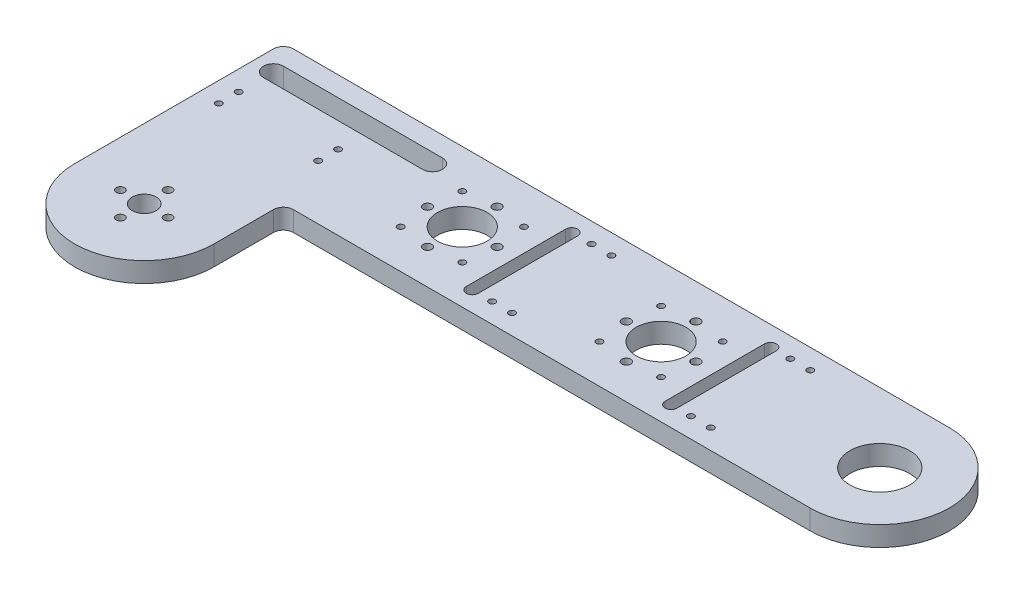
from build123d import *

# Parameters (mm, degrees)
SKETCH1_R               = 6
SKETCH1_R_2             = 15
BOSS_EXTRUDE1_DEPTH     = 5
FILLET1_R               = 5
SKETCH3_R               = 2.1
CUT_EXTRUDE1_DEPTH      = 352.212186577
CIRPATTERN1_COUNT       = 4
CUT_EXTRUDE2_DEPTH      = 352.212186577
CUT_EXTRUDE2_DEPTH_BACK = 352.212186577
SKETCH4_R               = 1.6
SKETCH5_R               = 1.6
SKETCH5_R_2             = 12.5
CUT_EXTRUDE3_DEPTH      = 352.212186577
SKETCH7_R               = 2.2
CUT_EXTRUDE5_DEPTH      = 352.212186577
LPATTERN1_COUNT         = 2
LPATTERN1_PITCH         = 100
CUT_EXTRUDE4_DEPTH      = 352.212186577
CUT_EXTRUDE4_DEPTH_BACK = 352.212186577


with BuildPart() as part:
    # Sketch1 → Boss-Extrude1 (new, symmetric)
    with BuildSketch(Plane(origin=(0, 0, 0), x_dir=(1, 0, 0), z_dir=(0, 1, 0))):
        with BuildLine():
            Line((35, 0), (35, 35))
            Line((35, 35), (300, 35))
            ThreePointArc((300, 35), (335, 70), (300, 105))
            Line((300, 105), (-35, 105))
            Line((-35, 105), (-35, 0))
            ThreePointArc((-35, 0), (0, -35), (35, 0))
        make_face()
        with Locations(Location((0, 0, 0), (0, 0, 270))):
            Circle(SKETCH1_R, mode=Mode.SUBTRACT)
        with Locations(Location((300, 70, 0), (0, 0, 270))):
            Circle(SKETCH1_R_2, mode=Mode.SUBTRACT)
    extrude(amount=BOSS_EXTRUDE1_DEPTH, both=True)

    # Fillet1
    fillet1_edges = [part.edges().sort_by_distance(p)[0] for p in [
        (-35, 0, -105),
        (35, 0, -35),
    ]]
    fillet(fillet1_edges, radius=FILLET1_R)

    # Sketch3 → Cut-Extrude1 (cut, symmetric)
    with BuildSketch(Plane(origin=(0, 5, 0), x_dir=(1, 0, 0), z_dir=(0, 1, 0))):
        with Locations(Location((0, -12, 0), (0, 0, 270))):
            Circle(SKETCH3_R)
    cut_extrude1 = extrude(amount=CUT_EXTRUDE1_DEPTH, both=True, mode=Mode.SUBTRACT)

    # CirPattern1: Cut-Extrude1 ×4 about axis
    cirpattern1_axis = Axis((0, 0, 0), (0, 1, 0))
    for i in range(1, CIRPATTERN1_COUNT):
        add(cut_extrude1.rotate(cirpattern1_axis, i * 360 / CIRPATTERN1_COUNT), mode=Mode.SUBTRACT)

    # Sketch4 → Cut-Extrude2 (cut, two sides: drawn at the far end of the back side and taken through both)
    with BuildSketch(Plane(origin=(0, 5, 0), x_dir=(1, 0, 0), z_dir=(0, 1, 0)).offset(-CUT_EXTRUDE2_DEPTH_BACK)):
        with Locations(Location((230, 95, 0), (0, 0, 270))):
            Circle(SKETCH4_R)
        with Locations(Location((240, 95, 0), (0, 0, 270))):
            Circle(SKETCH4_R)
        with Locations(Location((230, 45, 0), (0, 0, 270))):
            Circle(SKETCH4_R)
        with Locations(Location((240, 45, 0), (0, 0, 270))):
            Circle(SKETCH4_R)
        with Locations(Location((-25, 72.5, 0), (0, 0, 270))):
            Circle(SKETCH4_R)
        with Locations(Location((25, 72.5, 0), (0, 0, 270))):
            Circle(SKETCH4_R)
        with Locations(Location((-25, 62.5, 0), (0, 0, 270))):
            Circle(SKETCH4_R)
        with Locations(Location((25, 62.5, 0), (0, 0, 270))):
            Circle(SKETCH4_R)
        with Locations(Location((130, 95, 0), (0, 0, 270))):
            Circle(SKETCH4_R)
        with Locations(Location((140, 95, 0), (0, 0, 270))):
            Circle(SKETCH4_R)
        with Locations(Location((130, 45, 0), (0, 0, 270))):
            Circle(SKETCH4_R)
        with Locations(Location((140, 45, 0), (0, 0, 270))):
            Circle(SKETCH4_R)
    extrude(amount=CUT_EXTRUDE2_DEPTH + CUT_EXTRUDE2_DEPTH_BACK, mode=Mode.SUBTRACT)

    # Sketch5 → Cut-Extrude3 (cut, symmetric)
    with BuildSketch(Plane(origin=(0, 5, 0), x_dir=(1, 0, 0), z_dir=(0, 1, 0))):
        with Locations(Location((174.5, 85.5, 0), (0, 0, 270))):
            Circle(SKETCH5_R)
        with Locations(Location((174.5, 54.5, 0), (0, 0, 270))):
            Circle(SKETCH5_R)
        with Locations(Location((205.5, 54.5, 0), (0, 0, 270))):
            Circle(SKETCH5_R)
        with Locations(Location((205.5, 85.5, 0), (0, 0, 270))):
            Circle(SKETCH5_R)
        with Locations(Location((190, 70, 0), (0, 0, 270))):
            Circle(SKETCH5_R_2)
        with BuildLine():
            Line((223, 95), (223, 45))
            ThreePointArc((223, 45), (220, 42), (217, 45))
            Line((217, 45), (217, 95))
            ThreePointArc((217, 95), (220, 98), (223, 95))
        make_face()
    cut_extrude3 = extrude(amount=CUT_EXTRUDE3_DEPTH, both=True, mode=Mode.SUBTRACT)

    # Sketch7 → Cut-Extrude5 (cut, through all)
    with BuildSketch(Plane(origin=(0, 5, 0), x_dir=(1, 0, 0), z_dir=(0, 1, 0))):
        with Locations(Location((190, 87.5, 0), (0, 0, 270))):
            Circle(SKETCH7_R)
        with Locations(Location((172.5, 70, 0), (0, 0, 270))):
            Circle(SKETCH7_R)
        with Locations(Location((190, 52.5, 0), (0, 0, 270))):
            Circle(SKETCH7_R)
        with Locations(Location((207.5, 70, 0), (0, 0, 270))):
            Circle(SKETCH7_R)
    cut_extrude5 = extrude(amount=-CUT_EXTRUDE5_DEPTH, mode=Mode.SUBTRACT)

    # LPattern1: Cut-Extrude3, Cut-Extrude5 ×2
    with Locations(*[(-i * LPATTERN1_PITCH, 0, 0) for i in range(1, LPATTERN1_COUNT)]):
        add(cut_extrude3, mode=Mode.SUBTRACT)
        add(cut_extrude5, mode=Mode.SUBTRACT)

    # Sketch6 → Cut-Extrude4 (cut, two sides: drawn at the far end of the back side and taken through both)
    with BuildSketch(Plane(origin=(0, 5, 0), x_dir=(1, 0, 0), z_dir=(0, 1, 0)).offset(-CUT_EXTRUDE4_DEPTH_BACK)):
        with BuildLine():
            Line((-25, 95), (55, 95))
            ThreePointArc((55, 95), (60, 90), (55, 85))
            Line((55, 85), (-25, 85))
            ThreePointArc((-25, 85), (-30, 90), (-25, 95))
        make_face()
    extrude(amount=CUT_EXTRUDE4_DEPTH + CUT_EXTRUDE4_DEPTH_BACK, mode=Mode.SUBTRACT)


solid = part.part
